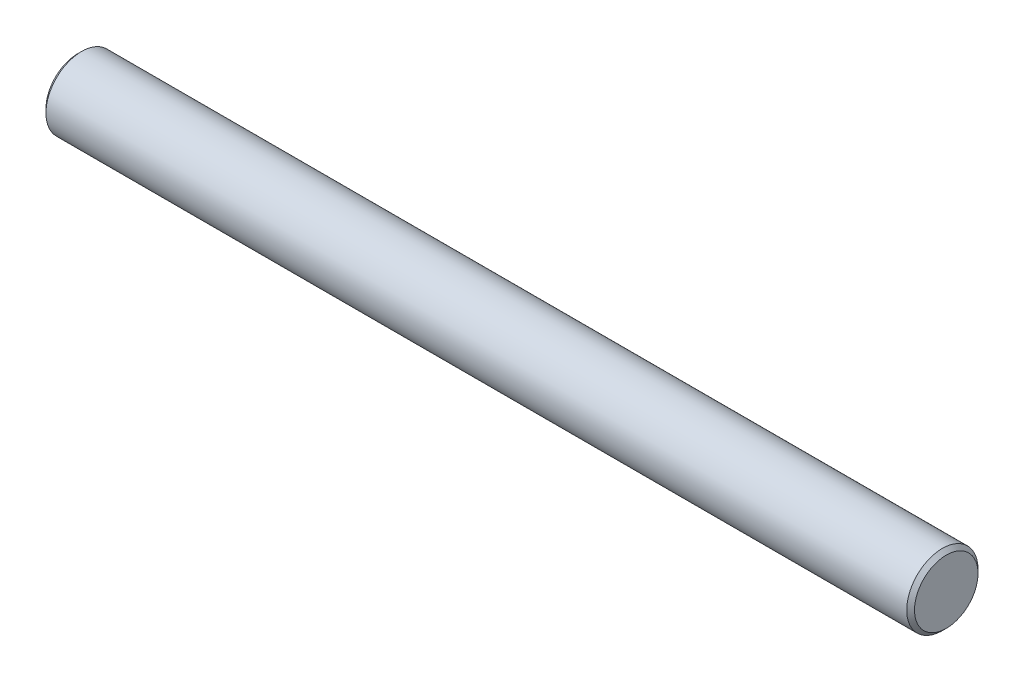
from build123d import *

# Parameters (mm, degrees)
SCALE1_SCALE = 0.3333


with BuildPart() as part:
    # Sketch1 → Revolve1 (revolve)
    with BuildSketch(Plane.XY, mode=Mode.PRIVATE) as revolve1_sk:
        Polygon((-33.5, 2.45), (-33.5, 0), (33.5, 0), (33.5, 2.45), (33.2, 2.75), (-33.2, 2.75), align=None)
    revolve(revolve1_sk.sketch.rotate(Axis((-33.5, 0, 0), (1, 0, 0)), 270), axis=Axis((-33.5, 0, 0), (1, 0, 0)))


with BuildPart() as part_1:
    # Scale1: scaled about (0, 0, 0)
    add(part.part.scale(SCALE1_SCALE))


solid = part_1.part
